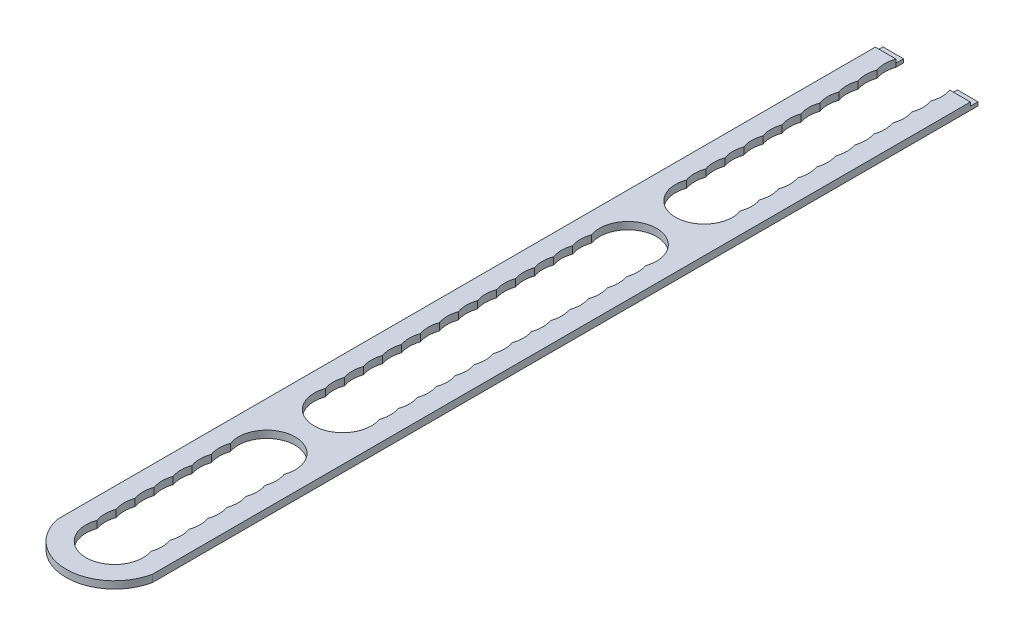
from build123d import *

# Parameters (mm, degrees)
BOSS_EXTRUDE4_DEPTH = 1.9
SKETCH7_W           = 5.428932188
SKETCH7_H           = 2
BOSS_EXTRUDE5_DEPTH = 0.95


with BuildPart() as part:
    # Sketch6 → Boss-Extrude4 (new body)
    with BuildSketch(Plane(origin=(0, 0, 0), x_dir=(1, 0, 0), z_dir=(0, 1, 0))):
        with BuildLine():
            ThreePointArc((-12.5, -192.5), (0, -202.747548784), (12.5, -192.5))
            Line((12.5, -192.5), (12.5, 22.5))
            Line((12.5, 22.5), (7.071067812, 22.5))
            ThreePointArc((7.071067812, 22.5), (7.5, 20), (7.071067812, 17.5))
            ThreePointArc((7.071067812, 17.5), (7.5, 15), (7.071067812, 12.5))
            ThreePointArc((7.071067812, 12.5), (7.5, 10), (7.071067812, 7.5))
            ThreePointArc((7.071067812, 7.5), (7.5, 5), (7.071067812, 2.5))
            ThreePointArc((7.071067812, 2.5), (7.5, 0), (7.071067812, -2.5))
            ThreePointArc((7.071067812, -2.5), (7.5, -5), (7.071067812, -7.5))
            ThreePointArc((7.071067812, -7.5), (7.5, -10), (7.071067812, -12.5))
            ThreePointArc((7.071067812, -12.5), (7.5, -15), (7.071067812, -17.5))
            ThreePointArc((7.071067812, -17.5), (7.5, -20), (7.071067812, -22.5))
            ThreePointArc((7.071067812, -22.5), (7.5, -25), (7.071067812, -27.5))
            ThreePointArc((7.071067812, -27.5), (7.5, -30), (7.071067812, -32.5))
            ThreePointArc((7.071067812, -32.5), (0, -42.5), (-7.071067812, -32.5))
            ThreePointArc((-7.071067812, -32.5), (-7.5, -30), (-7.071067812, -27.5))
            ThreePointArc((-7.071067812, -27.5), (-7.5, -25), (-7.071067812, -22.5))
            ThreePointArc((-7.071067812, -22.5), (-7.5, -20), (-7.071067812, -17.5))
            ThreePointArc((-7.071067812, -17.5), (-7.5, -15), (-7.071067812, -12.5))
            ThreePointArc((-7.071067812, -12.5), (-7.5, -10), (-7.071067812, -7.5))
            ThreePointArc((-7.071067812, -7.5), (-7.5, -5), (-7.071067812, -2.5))
            ThreePointArc((-7.071067812, -2.5), (-7.5, 0), (-7.071067812, 2.5))
            ThreePointArc((-7.071067812, 2.5), (-7.5, 5), (-7.071067812, 7.5))
            ThreePointArc((-7.071067812, 7.5), (-7.5, 10), (-7.071067812, 12.5))
            ThreePointArc((-7.071067812, 12.5), (-7.5, 15), (-7.071067812, 17.5))
            ThreePointArc((-7.071067812, 17.5), (-7.5, 20), (-7.071067812, 22.5))
            Line((-7.071067812, 22.5), (-12.5, 22.5))
            Line((-12.5, 22.5), (-12.5, -192.5))
        make_face()
        with BuildLine():
            ThreePointArc((7.071067812, -57.5), (7.5, -60), (7.071067812, -62.5))
            ThreePointArc((7.071067812, -62.5), (7.5, -65), (7.071067812, -67.5))
            ThreePointArc((7.071067812, -67.5), (7.5, -70), (7.071067812, -72.5))
            ThreePointArc((7.071067812, -72.5), (7.5, -75), (7.071067812, -77.5))
            ThreePointArc((7.071067812, -77.5), (7.5, -80), (7.071067812, -82.5))
            ThreePointArc((7.071067812, -82.5), (7.5, -85), (7.071067812, -87.5))
            ThreePointArc((7.071067812, -87.5), (7.5, -90), (7.071067812, -92.5))
            ThreePointArc((7.071067812, -92.5), (7.5, -95), (7.071067812, -97.5))
            ThreePointArc((7.071067812, -97.5), (7.5, -100), (7.071067812, -102.5))
            ThreePointArc((7.071067812, -102.5), (7.5, -105), (7.071067812, -107.5))
            ThreePointArc((7.071067812, -107.5), (7.5, -110), (7.071067812, -112.5))
            ThreePointArc((7.071067812, -112.5), (7.5, -115), (7.071067812, -117.5))
            ThreePointArc((7.071067812, -117.5), (7.5, -120), (7.071067812, -122.5))
            ThreePointArc((7.071067812, -122.5), (7.5, -125), (7.071067812, -127.5))
            ThreePointArc((7.071067812, -127.5), (0, -137.5), (-7.071067812, -127.5))
            ThreePointArc((-7.071067812, -127.5), (-7.5, -125), (-7.071067812, -122.5))
            ThreePointArc((-7.071067812, -122.5), (-7.5, -120), (-7.071067812, -117.5))
            ThreePointArc((-7.071067812, -117.5), (-7.5, -115), (-7.071067812, -112.5))
            ThreePointArc((-7.071067812, -112.5), (-7.5, -110), (-7.071067812, -107.5))
            ThreePointArc((-7.071067812, -107.5), (-7.5, -105), (-7.071067812, -102.5))
            ThreePointArc((-7.071067812, -102.5), (-7.5, -100), (-7.071067812, -97.5))
            ThreePointArc((-7.071067812, -97.5), (-7.5, -95), (-7.071067812, -92.5))
            ThreePointArc((-7.071067812, -92.5), (-7.5, -90), (-7.071067812, -87.5))
            ThreePointArc((-7.071067812, -87.5), (-7.5, -85), (-7.071067812, -82.5))
            ThreePointArc((-7.071067812, -82.5), (-7.5, -80), (-7.071067812, -77.5))
            ThreePointArc((-7.071067812, -77.5), (-7.5, -75), (-7.071067812, -72.5))
            ThreePointArc((-7.071067812, -72.5), (-7.5, -70), (-7.071067812, -67.5))
            ThreePointArc((-7.071067812, -67.5), (-7.5, -65), (-7.071067812, -62.5))
            ThreePointArc((-7.071067812, -62.5), (-7.5, -60), (-7.071067812, -57.5))
            ThreePointArc((-7.071067812, -57.5), (0, -47.5), (7.071067812, -57.5))
        make_face(mode=Mode.SUBTRACT)
        with BuildLine():
            ThreePointArc((7.071067812, -152.5), (7.5, -155), (7.071067812, -157.5))
            ThreePointArc((7.071067812, -157.5), (7.5, -160), (7.071067812, -162.5))
            ThreePointArc((7.071067812, -162.5), (7.5, -165), (7.071067812, -167.5))
            ThreePointArc((7.071067812, -167.5), (7.5, -170), (7.071067812, -172.5))
            ThreePointArc((7.071067812, -172.5), (7.5, -175), (7.071067812, -177.5))
            ThreePointArc((7.071067812, -177.5), (7.5, -180), (7.071067812, -182.5))
            ThreePointArc((7.071067812, -182.5), (7.5, -185), (7.071067812, -187.5))
            ThreePointArc((7.071067812, -187.5), (0, -197.5), (-7.071067812, -187.5))
            ThreePointArc((-7.071067812, -187.5), (-7.5, -185), (-7.071067812, -182.5))
            ThreePointArc((-7.071067812, -182.5), (-7.5, -180), (-7.071067812, -177.5))
            ThreePointArc((-7.071067812, -177.5), (-7.5, -175), (-7.071067812, -172.5))
            ThreePointArc((-7.071067812, -172.5), (-7.5, -170), (-7.071067812, -167.5))
            ThreePointArc((-7.071067812, -167.5), (-7.5, -165), (-7.071067812, -162.5))
            ThreePointArc((-7.071067812, -162.5), (-7.5, -160), (-7.071067812, -157.5))
            ThreePointArc((-7.071067812, -157.5), (-7.5, -155), (-7.071067812, -152.5))
            ThreePointArc((-7.071067812, -152.5), (0, -142.5), (7.071067812, -152.5))
        make_face(mode=Mode.SUBTRACT)
    extrude(amount=BOSS_EXTRUDE4_DEPTH)

    # Sketch7 → Boss-Extrude5 (add)
    with BuildSketch(Plane(origin=(0, 0, 0), x_dir=(1, 0, 0), z_dir=(0, 1, 0))):
        with Locations((-9.785533906, 23.5)):
            Rectangle(SKETCH7_W, SKETCH7_H)
        with Locations((9.785533906, 23.5)):
            Rectangle(SKETCH7_W, SKETCH7_H)
    extrude(amount=BOSS_EXTRUDE5_DEPTH)


solid = part.part
